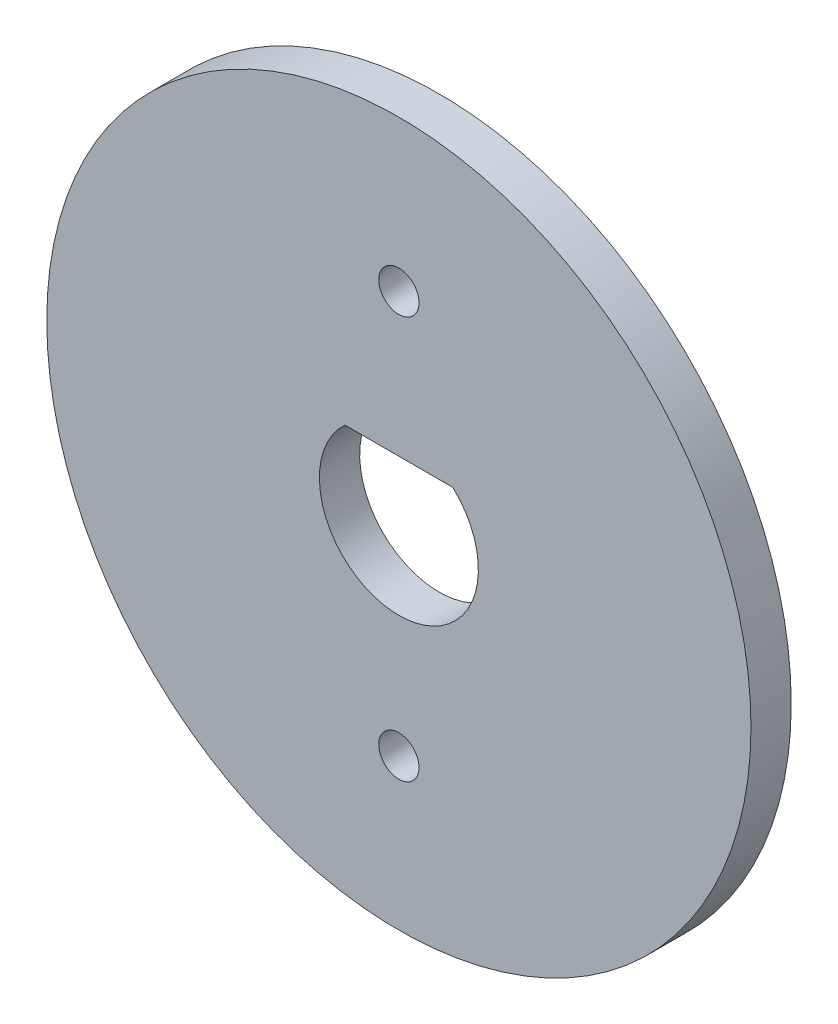
from build123d import *

# Parameters (mm, degrees)
SKETCH_1_R      = 17.5
SKETCH_1_R_2    = 1
EXTRUDE_1_DEPTH = 2


with BuildPart() as part:
    # Эскиз1 → Бобышка-Вытянуть1 (new body)
    with BuildSketch(Plane.XY):
        Circle(SKETCH_1_R)
        with Locations((0, 10)):
            Circle(SKETCH_1_R_2, mode=Mode.SUBTRACT)
        with Locations((0, -10)):
            Circle(SKETCH_1_R_2, mode=Mode.SUBTRACT)
        with BuildLine():
            Line((2.681883666, 2.9), (-2.681883666, 2.9))
            ThreePointArc((-2.681883666, 2.9), (0, -3.95), (2.681883666, 2.9))
        make_face(mode=Mode.SUBTRACT)
    extrude(amount=EXTRUDE_1_DEPTH)


solid = part.part
